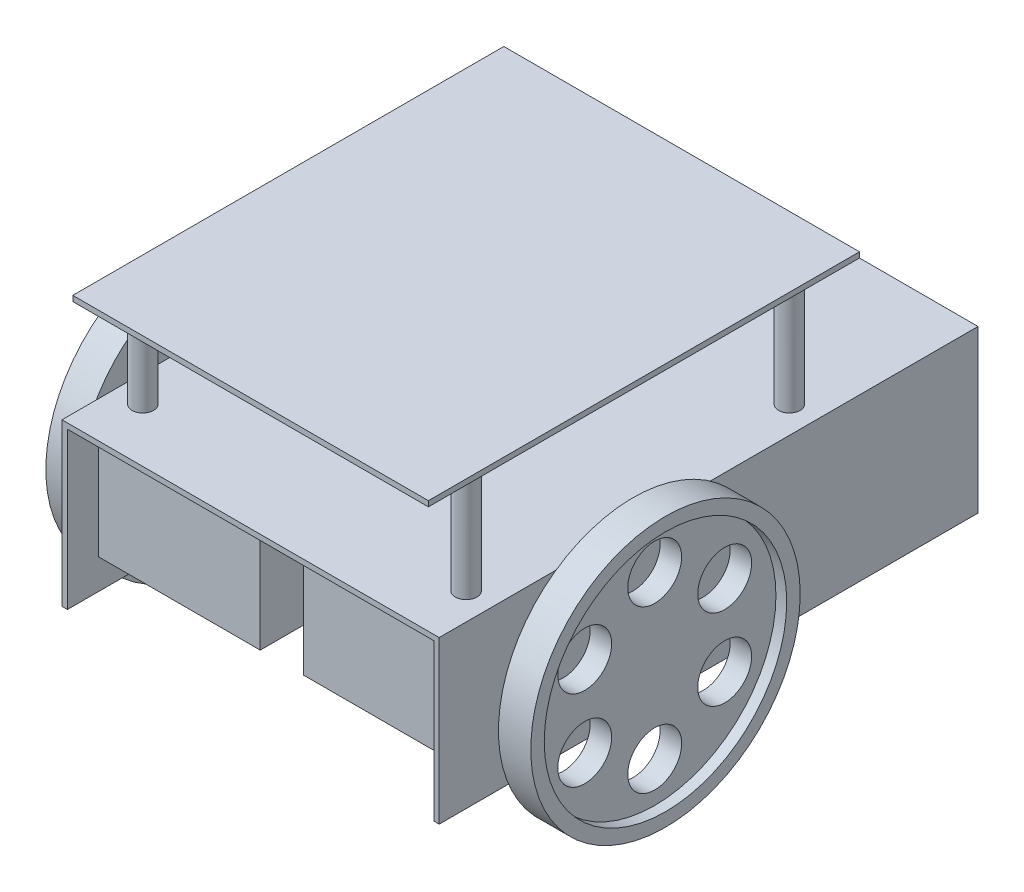
from build123d import *

# Parameters (mm, degrees)
SKETCH_1_W               = 70
SKETCH_1_H               = 100
EXTRUDE_1_DEPTH          = 30
SHELL_1_T                = -1
SKETCH_2_W               = 40
SKETCH_2_H               = 20
EXTRUDE_2_DEPTH          = 30
SKETCH_3_R               = 1.5
EXTRUDE_3_DEPTH          = 10
SKETCH_4_R               = 25
EXTRUDE_4_DEPTH          = 6
SKETCH_5_R               = 22.5
CUT_EXTRUDE_1_DEPTH      = 2
SKETCH_6_R               = 5
CUT_EXTRUDE_2_DEPTH      = 8
PATTERN_CIRCULAR_1_COUNT = 6
MIRROR_1_COPY_1_SKETCH_R = 5
MIRROR_1_COPY_1_DEPTH    = 8
MIRROR_1_COPY_2_SKETCH_R = 5
MIRROR_1_COPY_2_DEPTH    = 8
MIRROR_1_COPY_3_SKETCH_R = 5
MIRROR_1_COPY_3_DEPTH    = 8
MIRROR_1_COPY_4_SKETCH_R = 5
MIRROR_1_COPY_4_DEPTH    = 8
MIRROR_1_COPY_5_SKETCH_R = 5
MIRROR_1_COPY_5_DEPTH    = 8
SKETCH_9_R               = 14
CUT_EXTRUDE_4_DEPTH      = 8
SKETCH_8_W               = 3
SKETCH_8_H               = 29
CUT_EXTRUDE_3_DEPTH      = 8
SKETCH_10_R              = 1
EXTRUDE_5_DEPTH          = 14
SKETCH_11_R              = 2
EXTRUDE_6_DEPTH          = 20
SKETCH_12_W              = 66
SKETCH_12_H              = 80
EXTRUDE_7_DEPTH          = 1


with BuildPart() as part:
    # 草圖1 → 填料-伸長1 (new body)
    with BuildSketch(Plane(origin=(0, 0, 0), x_dir=(1, 0, 0), z_dir=(0, 1, 0))):
        with Locations((0, 50)):
            Rectangle(SKETCH_1_W, SKETCH_1_H)
    extrude(amount=EXTRUDE_1_DEPTH)

    # 薄殼1
    shell_1_openings = [part.faces().sort_by_distance(p)[0] for p in [
        (0, 0, -50),
        (0, 15, 0),
    ]]
    offset(amount=SHELL_1_T, openings=shell_1_openings, kind=Kind.INTERSECTION)

    # 草圖2 → 填料-伸長2 (add)
    with BuildSketch(Plane.ZY.offset(-34)):
        with Locations((-25.793166275, 15.578551741)):
            Rectangle(SKETCH_2_W, SKETCH_2_H)
    extrude_2 = extrude(amount=EXTRUDE_2_DEPTH)

    # 草圖3 → 填料-伸長3 (add)
    with BuildSketch(Plane(origin=(35, 0, 0), x_dir=(0, 0, -1), z_dir=(1, 0, 0))):
        with Locations(Location((32, 13.5, 0), (0, 0, 180))):
            Circle(SKETCH_3_R)
    extrude_3 = extrude(amount=EXTRUDE_3_DEPTH)

    # 草圖4 → 填料-伸長4 (add)
    with BuildSketch(Plane(origin=(45, 0, 0), x_dir=(0, 0, -1), z_dir=(1, 0, 0))):
        with Locations((32, 13.5)):
            Circle(SKETCH_4_R)
    extrude_4 = extrude(amount=-EXTRUDE_4_DEPTH)

    # 草圖5 → 除料-伸長1 (cut)
    with BuildSketch(Plane(origin=(45, 0, 0), x_dir=(0, 0, -1), z_dir=(1, 0, 0))):
        with Locations((32, 13.5)):
            Circle(SKETCH_5_R)
    cut_extrude_1 = extrude(amount=-CUT_EXTRUDE_1_DEPTH, mode=Mode.SUBTRACT)

    # 草圖6 → 除料-伸長2 (cut)
    with BuildSketch(Plane(origin=(43, 0, 0), x_dir=(0, 0, -1), z_dir=(1, 0, 0))):
        with Locations((32, 28.5)):
            Circle(SKETCH_6_R)
    cut_extrude_2 = extrude(amount=-CUT_EXTRUDE_2_DEPTH, mode=Mode.SUBTRACT)

    # 環狀複製排列1: 除料-伸長2 ×6 about axis
    pattern_circular_1_axis = Axis((0, 13.5, -32), (1, 0, 0))
    for i in range(1, PATTERN_CIRCULAR_1_COUNT):
        add(cut_extrude_2.rotate(pattern_circular_1_axis, i * 360 / PATTERN_CIRCULAR_1_COUNT), mode=Mode.SUBTRACT)

    # 鏡射1: 填料-伸長2, 填料-伸長3, 填料-伸長4, 除料-伸長1, 除料-伸長2 across plane
    add(extrude_2.mirror(Plane(origin=(0, 0, 0), x_dir=(0, 0, 1), z_dir=(1, 0, 0))))
    add(extrude_3.mirror(Plane(origin=(0, 0, 0), x_dir=(0, 0, 1), z_dir=(1, 0, 0))))
    add(extrude_4.mirror(Plane(origin=(0, 0, 0), x_dir=(0, 0, 1), z_dir=(1, 0, 0))))
    add(cut_extrude_1.mirror(Plane(origin=(0, 0, 0), x_dir=(0, 0, 1), z_dir=(1, 0, 0))), mode=Mode.SUBTRACT)
    add(cut_extrude_2.mirror(Plane(origin=(0, 0, 0), x_dir=(0, 0, 1), z_dir=(1, 0, 0))), mode=Mode.SUBTRACT)

    # 鏡射1 copy 1 sketch → 鏡射1 copy 1 (cut)
    with BuildSketch(Plane(origin=(-43, -20.962812921, -27.691342951), x_dir=(0, 0.8660254037844386, -0.5000000000000001), z_dir=(-1, 0, 0))):
        with Locations((32, -28.5)):
            Circle(MIRROR_1_COPY_1_SKETCH_R)
    extrude(amount=-MIRROR_1_COPY_1_DEPTH, mode=Mode.SUBTRACT)

    # 鏡射1 copy 2 sketch → 鏡射1 copy 2 (cut)
    with BuildSketch(Plane(origin=(-43, -7.462812921, -59.691342951), x_dir=(0, 0.8660254037844387, 0.4999999999999998), z_dir=(-1, 0, 0))):
        with Locations((32, -28.5)):
            Circle(MIRROR_1_COPY_2_SKETCH_R)
    extrude(amount=-MIRROR_1_COPY_2_DEPTH, mode=Mode.SUBTRACT)

    # 鏡射1 copy 3 sketch → 鏡射1 copy 3 (cut)
    with BuildSketch(Plane(origin=(-43, 27, -64), x_dir=(0, 0, 1), z_dir=(-1, 0, 0))):
        with Locations((32, -28.5)):
            Circle(MIRROR_1_COPY_3_SKETCH_R)
    extrude(amount=-MIRROR_1_COPY_3_DEPTH, mode=Mode.SUBTRACT)

    # 鏡射1 copy 4 sketch → 鏡射1 copy 4 (cut)
    with BuildSketch(Plane(origin=(-43, 47.962812921, -36.308657049), x_dir=(0, -0.8660254037844384, 0.5000000000000004), z_dir=(-1, 0, 0))):
        with Locations((32, -28.5)):
            Circle(MIRROR_1_COPY_4_SKETCH_R)
    extrude(amount=-MIRROR_1_COPY_4_DEPTH, mode=Mode.SUBTRACT)

    # 鏡射1 copy 5 sketch → 鏡射1 copy 5 (cut)
    with BuildSketch(Plane(origin=(-43, 34.462812921, -4.308657049), x_dir=(0, -0.8660254037844386, -0.5000000000000001), z_dir=(-1, 0, 0))):
        with Locations((32, -28.5)):
            Circle(MIRROR_1_COPY_5_SKETCH_R)
    extrude(amount=-MIRROR_1_COPY_5_DEPTH, mode=Mode.SUBTRACT)

    # 草圖9 → 除料-伸長4 (cut)
    with BuildSketch(Plane(origin=(0, 0, -100), x_dir=(-1, 0, 0), z_dir=(0, 0, -1))):
        Circle(SKETCH_9_R)
    extrude(amount=-CUT_EXTRUDE_4_DEPTH, mode=Mode.SUBTRACT)

    # 草圖8 → 除料-伸長3 (cut)
    with BuildSketch(Plane(origin=(0, 0, -100), x_dir=(-1, 0, 0), z_dir=(0, 0, -1))):
        with Locations((32.5, 14.5)):
            Rectangle(SKETCH_8_W, SKETCH_8_H)
        with Locations((-32.5, 14.5)):
            Rectangle(SKETCH_8_W, SKETCH_8_H)
    extrude(amount=-CUT_EXTRUDE_3_DEPTH, mode=Mode.SUBTRACT)



with BuildPart() as body_2:
    # 草圖7 → 旋轉1 (revolve)
    with BuildSketch(Plane(origin=(0, 0, -100), x_dir=(-1, 0, 0), z_dir=(0, 0, -1))):
        with BuildLine():
            Line((-12, 0), (12, 0))
            ThreePointArc((12, 0), (0, 12), (-12, 0))
        make_face()
    revolve(axis=Axis((12, 0, -100), (-1, 0, 0)))


with BuildPart() as part_1:
    add(part.part)

    add(body_2.part)  # 填料-伸長5 merges body 2
    # 草圖10 → 填料-伸長5 (add, symmetric)
    with BuildSketch(Plane(origin=(0, 0, 0), x_dir=(0, 0, -1), z_dir=(1, 0, 0))):
        with Locations(Location((100, 0, 0), (0, 0, 90))):
            Circle(SKETCH_10_R)
    extrude(amount=EXTRUDE_5_DEPTH, both=True)

    # 草圖11 → 填料-伸長6 (add)
    with BuildSketch(Plane(origin=(0, 30, 0), x_dir=(1, 0, 0), z_dir=(0, 1, 0))):
        with Locations(Location((30, 70, 0), (0, 0, 90))):
            Circle(SKETCH_11_R)
        with Locations(Location((-30, 70, 0), (0, 0, 90))):
            Circle(SKETCH_11_R)
        with Locations(Location((-30, 10, 0), (0, 0, 90))):
            Circle(SKETCH_11_R)
        with Locations(Location((30, 10, 0), (0, 0, 90))):
            Circle(SKETCH_11_R)
    extrude(amount=EXTRUDE_6_DEPTH)

    # 草圖12 → 填料-伸長7 (add)
    with BuildSketch(Plane(origin=(0, 50, 0), x_dir=(1, 0, 0), z_dir=(0, 1, 0))):
        with Locations((0, 40)):
            Rectangle(SKETCH_12_W, SKETCH_12_H)
    extrude(amount=EXTRUDE_7_DEPTH)


solid = part_1.part
